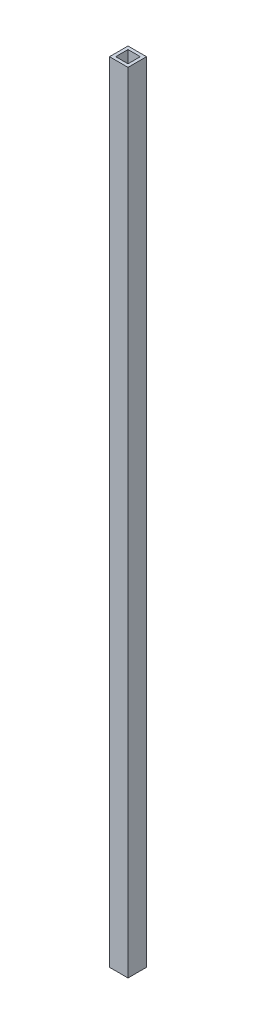
from build123d import *

# Parameters (mm, degrees)
SKETCH1_W           = 19.05
SKETCH1_H           = 19.05
SKETCH1_W_2         = 12.7
SKETCH1_H_2         = 12.7
EXTRUDE_THIN1_DEPTH = 812.8


with BuildPart() as part:
    # Sketch1 → Extrude-Thin1 (new body)
    with BuildSketch(Plane(origin=(0, 0, 0), x_dir=(1, 0, 0), z_dir=(0, 1, 0))):
        with Locations((9.525, 9.525)):
            Rectangle(SKETCH1_W, SKETCH1_H)
        with Locations((9.525, 9.525)):
            Rectangle(SKETCH1_W_2, SKETCH1_H_2, mode=Mode.SUBTRACT)
    extrude(amount=EXTRUDE_THIN1_DEPTH)


solid = part.part
